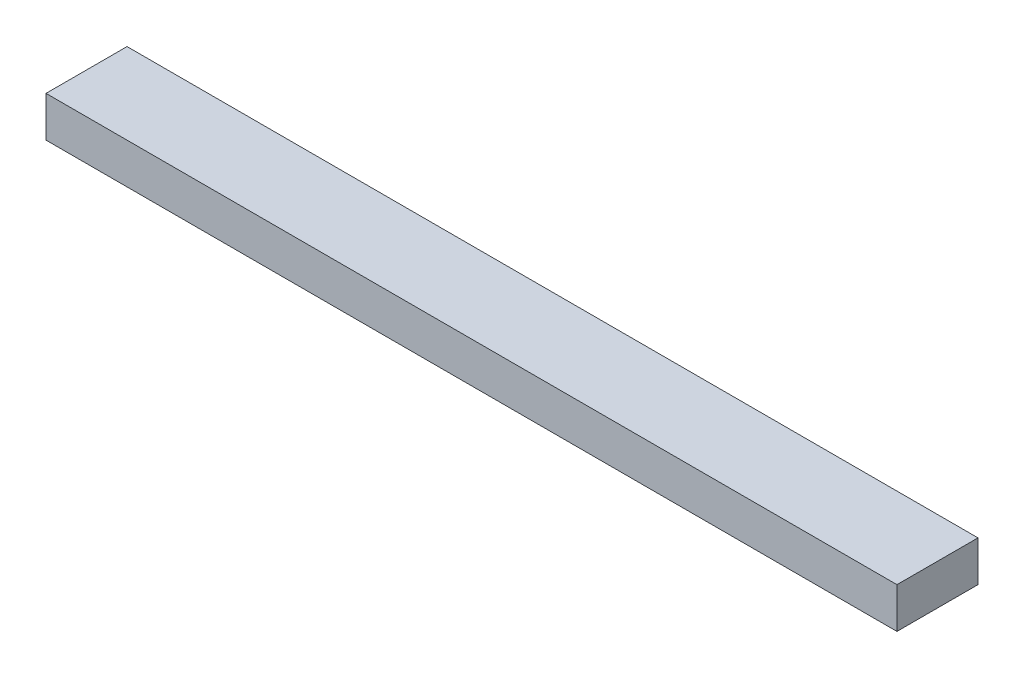
from build123d import *

# Parameters (mm, degrees)
BOSS_EXTRUDE1_DEPTH      = 266.7
BOSS_EXTRUDE1_DEPTH_BACK = 266.7
SKETCH1_W                = 50.8
SKETCH1_H                = 25.4


with BuildPart() as part:
    # Sketch1 → Boss-Extrude1 (new, two sides: drawn at the far end of the back side and taken through both)
    with BuildSketch(Plane(origin=(0, 0, 0), x_dir=(0, 0, -1), z_dir=(1, 0, 0)).offset(-BOSS_EXTRUDE1_DEPTH_BACK)):
        with Locations((215.9, 38.1)):
            Rectangle(SKETCH1_W, SKETCH1_H)
    extrude(amount=BOSS_EXTRUDE1_DEPTH + BOSS_EXTRUDE1_DEPTH_BACK)


solid = part.part
